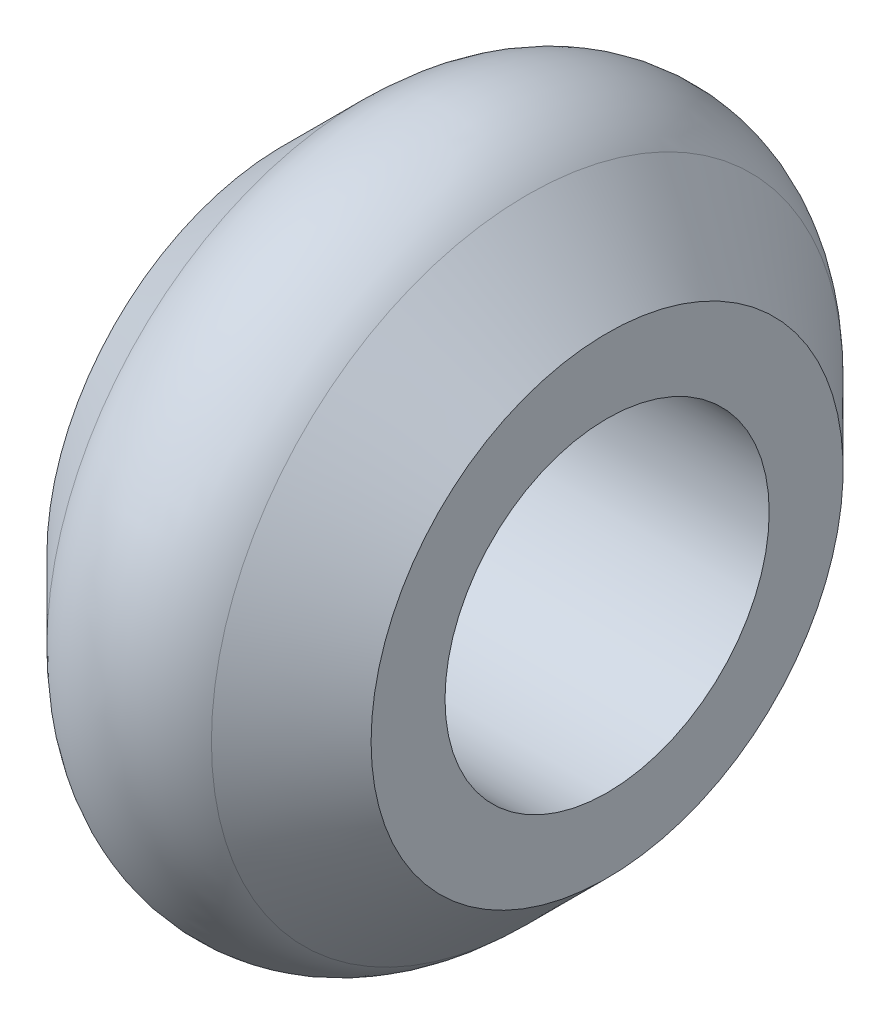
from build123d import *

# Parameters (mm, degrees)
FILLET1_R = 3.9878


with BuildPart() as part:
    # Sketch1 → Revolve1 (revolve)
    with BuildSketch(Plane.XY, mode=Mode.PRIVATE) as revolve1_sk:
        Polygon((-5.55625, 5.55625), (5.55625, 5.55625), (5.55625, 8.0899), (0, 13.64615), (-5.55625, 8.0899), align=None)
    revolve(revolve1_sk.sketch.rotate(Axis((-5.55625, 0, 0), (1, 0, 0)), 90), axis=Axis((-5.55625, 0, 0), (1, 0, 0)))

    # Fillet1
    fillet1_edges = [part.edges().sort_by_distance(p)[0] for p in [
        (0, 0, -13.64615),
    ]]
    fillet(fillet1_edges, radius=FILLET1_R)


solid = part.part
